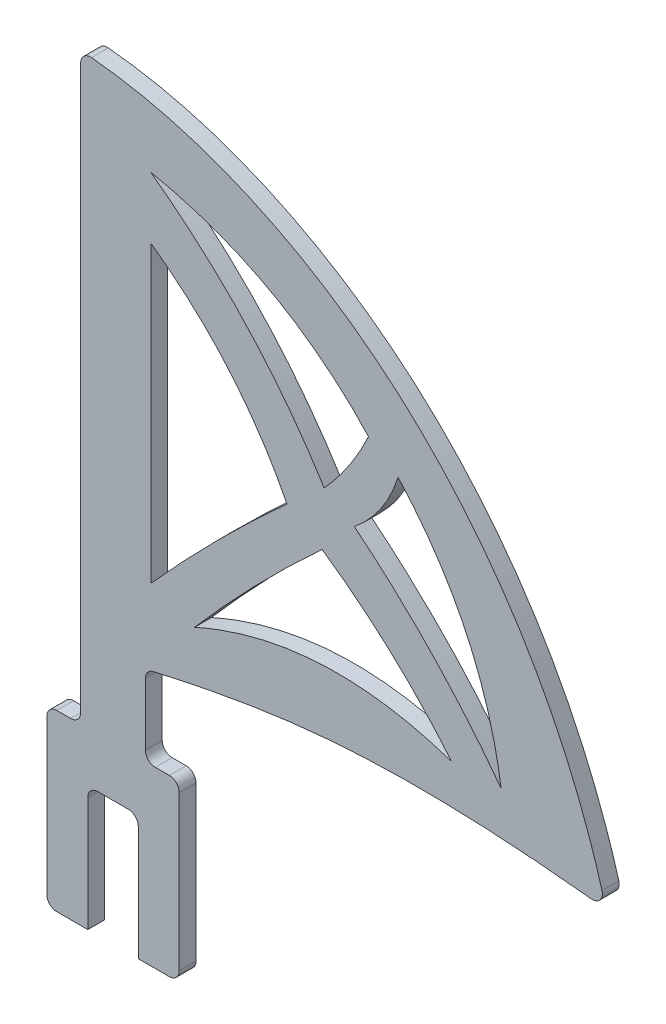
from build123d import *

# Parameters (mm, degrees)
SKETCH1_W           = 16.51
SKETCH1_H           = 22.225
BOSS_EXTRUDE1_DEPTH = 4.2926
FILLET1_R           = 2.54
SKETCH3_W           = 12.8778
SKETCH3_H           = 31.75
CUT_EXTRUDE1_DEPTH  = 4.2926
FILLET2_R           = 2.54
CUT_EXTRUDE2_DEPTH  = 4.2926


with BuildPart() as part:
    # Sketch1 → Boss-Extrude1 (new body)
    with BuildSketch(Plane.XY):
        with BuildLine():
            Line((-8.255, 171.081987477), (-8.255, 146.05))
            Line((-8.255, 146.05), (8.255, 146.05))
            Line((8.255, 146.05), (8.255, 42.644883355))
            add(Edge.make_bspline(
                [(125.716580007, 48.373759919), (101.454363005, 51.05167226), (61.670696801, 53.384876658), (22.758908367, 46.056998678), (8.255, 42.644883355)],
                knots=[0, 0, 0, 0, 0.621556192, 1, 1, 1, 1], degree=3))
            add(Edge.make_bspline(
                [(-8.255, 171.081987477), (8.482506786, 169.920834594), (37.696093446, 161.351973623), (91.678547842, 125.040727361), (116.930099327, 81.490043726), (125.716580007, 48.373759919)],
                knots=[0, 0, 0, 0, 0.260197261, 0.464601463, 1, 1, 1, 1], degree=3))
        make_face()
        Polygon((-8.255, 146.05), (-8.255, 22.225), (8.255, 22.225), (8.255, 42.644883355), (8.255, 146.05), align=None)
        with Locations((0, 11.1125)):
            Rectangle(SKETCH1_W, SKETCH1_H)
        Polygon((-16.891, 22.225), (-16.891, -22.225), (16.891, -22.225), (16.891, 22.225), (8.255, 22.225), (8.255, 0), (-8.255, 0), (-8.255, 22.225), align=None)
    extrude(amount=BOSS_EXTRUDE1_DEPTH)

    # Fillet1
    fillet1_edges = [part.edges().sort_by_distance(p)[0] for p in [
        (16.891, 22.225, 2.1463),
        (16.891, -22.225, 2.1463),
        (-16.891, -22.225, 2.1463),
        (-16.891, 22.225, 2.1463),
        (-8.255, 22.225, 2.1463),
        (8.255, 42.644883355, 2.1463),
        (8.255, 22.225, 2.1463),
    ]]
    fillet(fillet1_edges, radius=FILLET1_R)

    # Sketch3 → Cut-Extrude1 (cut)
    with BuildSketch(Plane.XY.offset(4.2926)):
        with Locations((0, -6.35)):
            Rectangle(SKETCH3_W, SKETCH3_H)
    extrude(amount=-CUT_EXTRUDE1_DEPTH, mode=Mode.SUBTRACT)

    # Fillet2
    fillet2_edges = [part.edges().sort_by_distance(p)[0] for p in [
        (6.4389, 9.525, 2.1463),
        (-6.4389, 9.525, 2.1463),
        (125.716580007, 48.373759919, 2.1463),
        (-8.255, 171.081987477, 2.1463),
    ]]
    fillet(fillet2_edges, radius=FILLET2_R)

    # Sketch4 → Cut-Extrude2 (cut)
    with BuildSketch(Plane(origin=(0, 0, 0), x_dir=(-1, 0, 0), z_dir=(0, 0, -1))):
        with BuildLine():
            Line((-9.622290965, 62.279587003), (-9.622290965, 137.454872526))
            add(Edge.make_bspline(
                [(-9.622290965, 137.454872526), (-31.976257123, 121.615669166), (-44.359940554, 97.193181134)],
                knots=[0, 0, 0, 1, 1, 1], degree=2))
            add(Edge.make_bspline(
                [(-44.359940554, 97.193181134), (-26.073912196, 80.643285354), (-9.622290965, 62.279587003)],
                knots=[0, 0, 0, 1, 1, 1], degree=2))
        make_face()
        with BuildLine():
            add(Edge.make_bspline(
                [(-65.171801242, 122.457122028), (-42.991307033, 146.419627916), (-9.622290965, 153.095219352)],
                knots=[0, 0, 0, 1, 1, 1], degree=2))
            add(Edge.make_bspline(
                [(-9.622290965, 153.095219352), (-36.425668846, 133.501984123), (-53.862303727, 105.466469115)],
                knots=[0, 0, 0, 1, 1, 1], degree=2))
            add(Edge.make_bspline(
                [(-65.171801242, 122.457122028), (-60.781840314, 113.076876159), (-53.862303727, 105.466469115)],
                knots=[0, 0, 0, 1, 1, 1], degree=2))
        make_face()
        with BuildLine():
            add(Edge.make_bspline(
                [(-72.704015401, 117.289439294), (-94.417782838, 93.472755404), (-98.988348102, 61.673623274)],
                knots=[0, 0, 0, 1, 1, 1], degree=2))
            add(Edge.make_bspline(
                [(-98.988348102, 61.673623274), (-82.698421223, 83.657662509), (-61.533499928, 100.794910417)],
                knots=[0, 0, 0, 1, 1, 1], degree=2))
            add(Edge.make_bspline(
                [(-72.704015401, 117.289439294), (-69.576013453, 107.271375671), (-61.533499928, 100.794910417)],
                knots=[0, 0, 0, 1, 1, 1], degree=2))
        make_face()
        with BuildLine():
            add(Edge.make_bspline(
                [(-86.321212925, 61.303058161), (-71.955525072, 78.774376711), (-53.329729843, 91.61675501)],
                knots=[0, 0, 0, 1, 1, 1], degree=2))
            add(Edge.make_bspline(
                [(-53.329729843, 91.61675501), (-36.084210617, 75.847325958), (-20.792276935, 58.171365413)],
                knots=[0, 0, 0, 1, 1, 1], degree=2))
            add(Edge.make_bspline(
                [(-86.321212925, 61.303058161), (-52.898087225, 72.583199638), (-20.792276935, 58.171365413)],
                knots=[0, 0, 0, 1, 1, 1], degree=2))
        make_face()
    extrude(amount=-CUT_EXTRUDE2_DEPTH, mode=Mode.SUBTRACT)


solid = part.part
